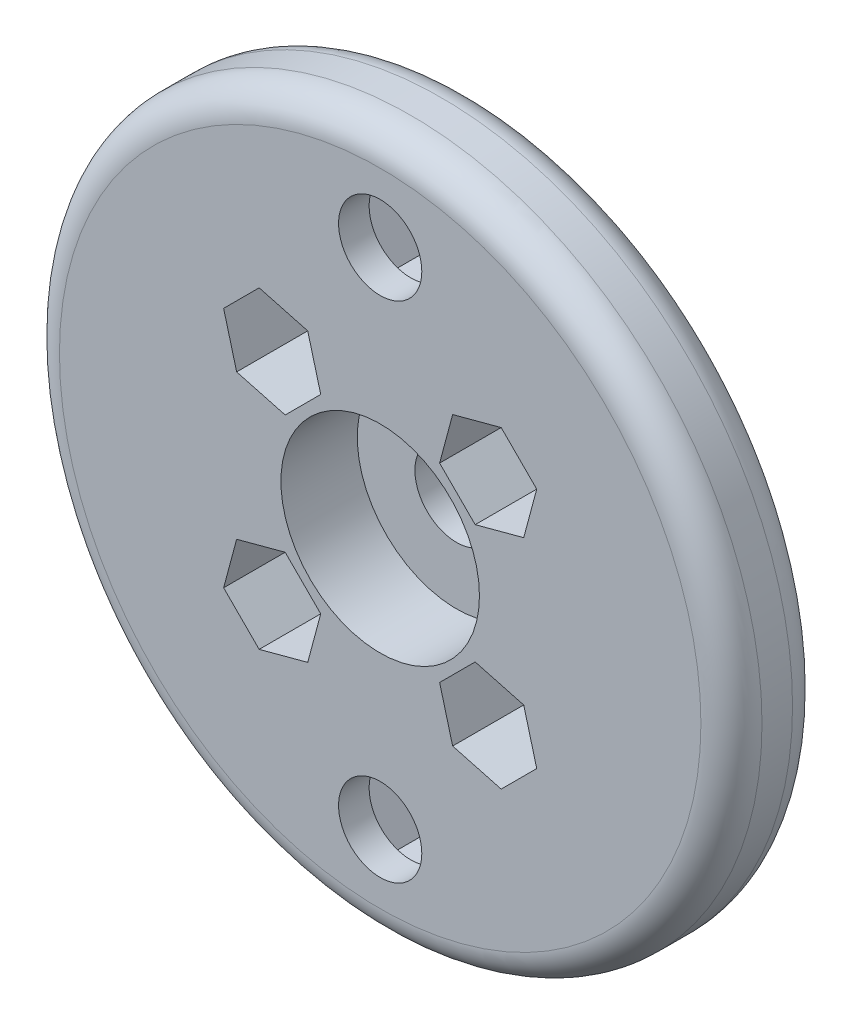
from build123d import *

# Parameters (mm, degrees)
SKETCH1_R               = 23
BOSS_EXTRUDE3_DEPTH     = 10
SKETCH3_R               = 23
SKETCH3_R_2             = 13
CUT_EXTRUDE1_DEPTH      = 4
SKETCH4_R               = 1.725
SKETCH4_R_2             = 2.725
CUT_EXTRUDE2_DEPTH      = 35.029399054
SKETCH5_R               = 6.5
CUT_EXTRUDE3_DEPTH      = 5
SKETCH6_R               = 2.725
CUT_EXTRUDE4_DEPTH      = 35.029399054
CUT_EXTRUDE5_DEPTH      = 34.075670817
CUT_EXTRUDE5_DEPTH_BACK = 4
FILLET1_R               = 2


with BuildPart() as part:
    # Sketch1 → Boss-Extrude3 (new body)
    with BuildSketch(Plane.XY):
        Circle(SKETCH1_R)
    extrude(amount=BOSS_EXTRUDE3_DEPTH)

    # Sketch3 → Cut-Extrude1 (cut)
    with BuildSketch(Plane(origin=(0, 0, 0), x_dir=(-1, 0, 0), z_dir=(0, 0, -1))):
        Circle(SKETCH3_R)
        Circle(SKETCH3_R_2, mode=Mode.SUBTRACT)
    extrude(amount=-CUT_EXTRUDE1_DEPTH, mode=Mode.SUBTRACT)

    # Sketch4 → Cut-Extrude2 (cut, through all)
    with BuildSketch(Plane(origin=(0, 0, 0), x_dir=(-1, 0, 0), z_dir=(0, 0, -1))):
        with Locations((-7.071067812, -7.071067812)):
            Circle(SKETCH4_R)
        with Locations((7.071067812, 7.071067812)):
            Circle(SKETCH4_R)
        Circle(SKETCH4_R_2)
        with Locations((-7.071067812, 7.071067812)):
            Circle(SKETCH4_R)
        with Locations((7.071067812, -7.071067812)):
            Circle(SKETCH4_R)
    extrude(amount=-CUT_EXTRUDE2_DEPTH, mode=Mode.SUBTRACT)

    # Sketch5 → Cut-Extrude3 (cut)
    with BuildSketch(Plane.XY.offset(10)):
        Circle(SKETCH5_R)
        Polygon((-7.92281451, 10.249829766), (-10.249829766, 7.92281451), (-9.398083068, 4.744052556), (-6.219321113, 3.892305858), (-3.892305858, 6.219321113), (-4.744052556, 9.398083068), align=None)
        Polygon((9.398083068, -4.744052556), (6.219321113, -3.892305858), (3.892305858, -6.219321113), (4.744052556, -9.398083068), (7.92281451, -10.249829766), (10.249829766, -7.92281451), align=None)
        Polygon((-3.892305858, -6.219321113), (-6.219321113, -3.892305858), (-9.398083068, -4.744052556), (-10.249829766, -7.92281451), (-7.92281451, -10.249829766), (-4.744052556, -9.398083068), align=None)
        Polygon((9.398083068, 4.744052556), (10.249829766, 7.92281451), (7.92281451, 10.249829766), (4.744052556, 9.398083068), (3.892305858, 6.219321113), (6.219321113, 3.892305858), align=None)
    extrude(amount=-CUT_EXTRUDE3_DEPTH, mode=Mode.SUBTRACT)

    # Sketch6 → Cut-Extrude4 (cut, through all)
    with BuildSketch(Plane.XY.offset(10)):
        with Locations((0, 16.5)):
            Circle(SKETCH6_R)
        with Locations((0, -16.5)):
            Circle(SKETCH6_R)
    extrude(amount=-CUT_EXTRUDE4_DEPTH, mode=Mode.SUBTRACT)

    # Sketch7 → Cut-Extrude5 (cut, two sides: drawn at the far end of the back side and taken through both)
    with BuildSketch(Plane(origin=(0, 0, 4), x_dir=(-1, 0, 0), z_dir=(0, 0, -1)).offset(-CUT_EXTRUDE5_DEPTH_BACK)):
        Polygon((4.734272207, 16.5), (2.367136104, 20.6), (-2.367136104, 20.6), (-4.734272207, 16.5), (-2.367136104, 12.4), (2.367136104, 12.4), align=None)
        Polygon((4.734272207, -16.5), (2.367136104, -12.4), (-2.367136104, -12.4), (-4.734272207, -16.5), (-2.367136104, -20.6), (2.367136104, -20.6), align=None)
    extrude(amount=CUT_EXTRUDE5_DEPTH + CUT_EXTRUDE5_DEPTH_BACK, mode=Mode.SUBTRACT)

    # Fillet1
    fillet1_edges = [part.edges().sort_by_distance(p)[0] for p in [
        (13, 0, 4),
        (-13, 0, 4),
        (-23, 0, 4),
        (-23, 0, 10),
    ]]
    fillet(fillet1_edges, radius=FILLET1_R)


solid = part.part
